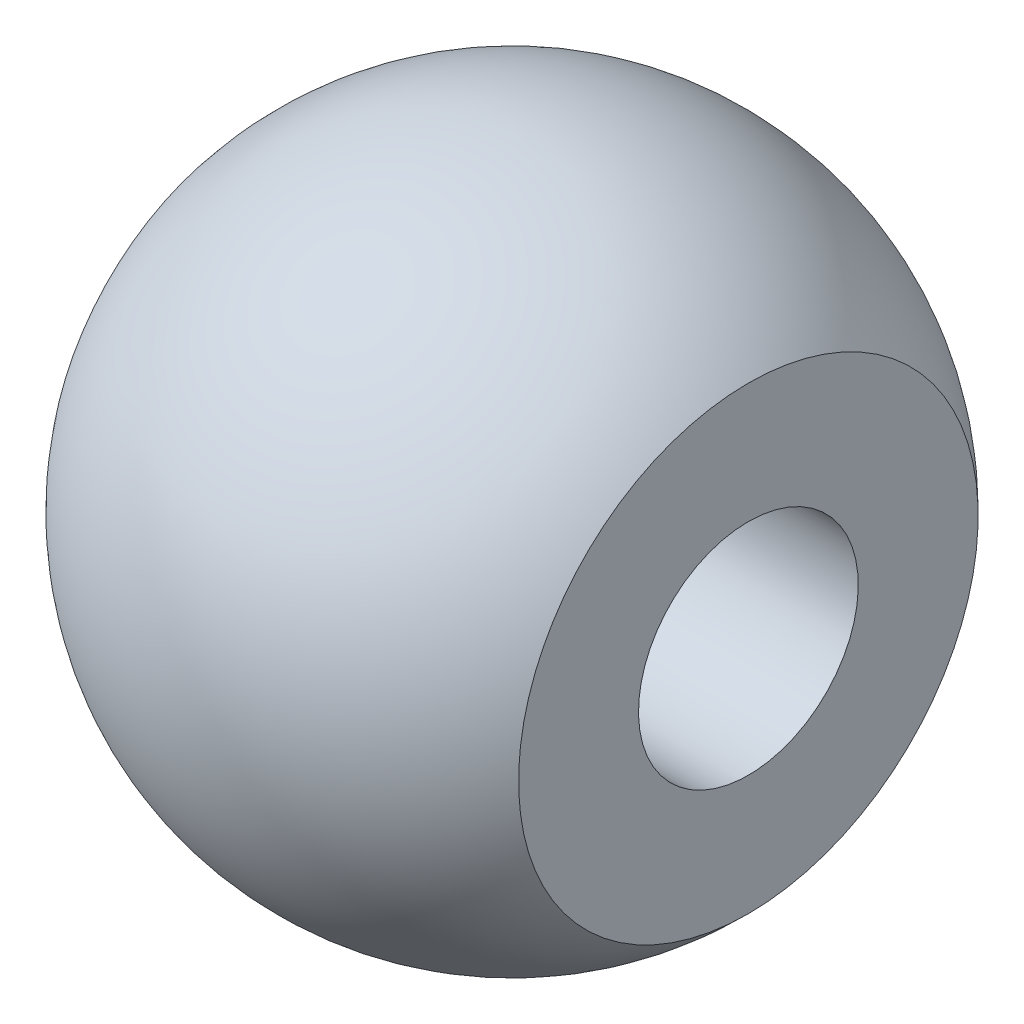
from build123d import *


with BuildPart() as part:
    # Sketch3 → Revolve2 (revolve)
    with BuildSketch(Plane.XY):
        with BuildLine():
            Line((-3.698063087, -2), (-4.698063087, -3.732050808))
            ThreePointArc((-4.698063087, -3.732050808), (-0.299926627, -5.992498979), (4.301936913, -4.182503891))
            Line((4.301936913, -4.182503891), (4.301936913, -2))
            Line((4.301936913, -2), (-3.698063087, -2))
        make_face()
    revolve(axis=Axis((4.301936913, 0, 0), (-1, 0, 0)))


solid = part.part
